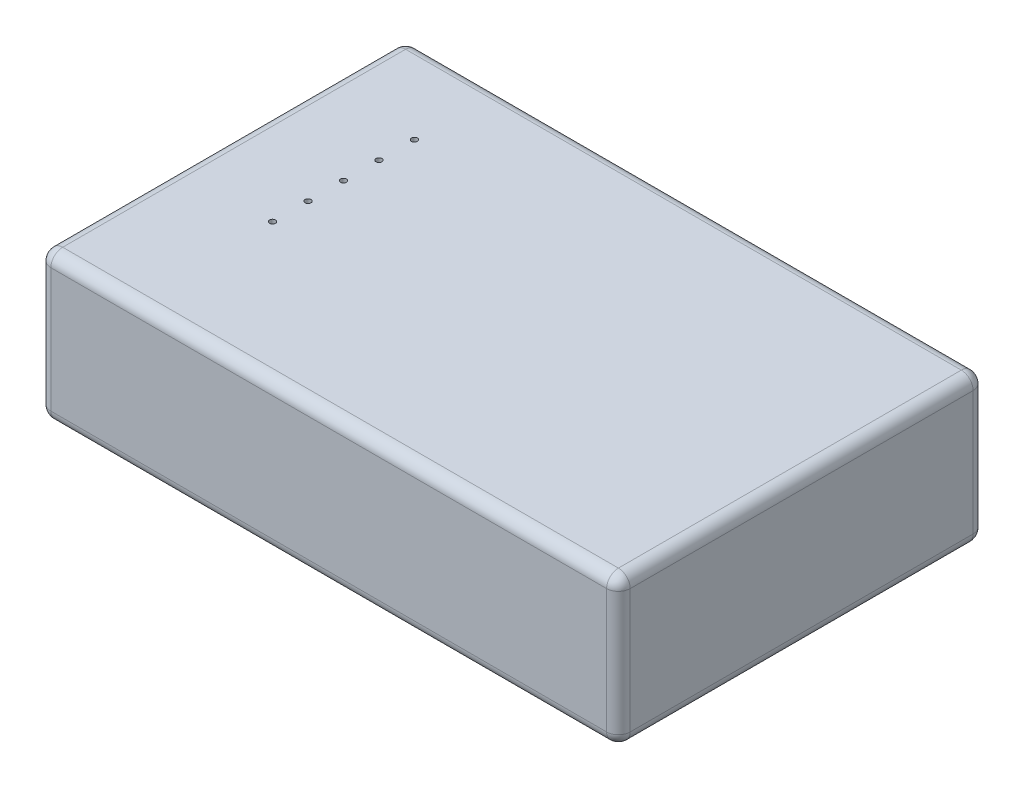
from build123d import *

# Parameters (mm, degrees)
SKETCH2_W           = 98
SKETCH2_H           = 62
BOSS_EXTRUDE1_DEPTH = 25
SKETCH3_W           = 9.5
SKETCH3_H           = 12
BOSS_EXTRUDE4_DEPTH = 1
SKETCH3_5_W         = 9.5
SKETCH3_5_H         = 12
CUT_EXTRUDE1_DEPTH  = 1
SKETCH4_R           = 3.25
CUT_EXTRUDE2_DEPTH  = 10
SKETCH5_R           = 0.5
BOSS_EXTRUDE5_DEPTH = 8
SKETCH6_W           = 7
SKETCH6_H           = 14
CUT_EXTRUDE9_DEPTH  = 10
SKETCH7_W           = 1.559437484
SKETCH7_H           = 10
BOSS_EXTRUDE6_DEPTH = 9
SKETCH8_W           = 15
SKETCH8_H           = 10
BOSS_EXTRUDE7_DEPTH = 2
BOSS_EXTRUDE7_TAPER = 30
BOSS_EXTRUDE8_DEPTH = 6
FILLET5_R           = 2
SKETCH10_R          = 2.5
CUT_EXTRUDE10_DEPTH = 6
SKETCH11_R          = 0.5
CUT_EXTRUDE11_DEPTH = 3


with BuildPart() as part:
    # Sketch2 → Boss-Extrude1 (new body)
    with BuildSketch(Plane(origin=(0, 0, 0), x_dir=(1, 0, 0), z_dir=(0, 1, 0))):
        Rectangle(SKETCH2_W, SKETCH2_H)
    extrude(amount=BOSS_EXTRUDE1_DEPTH)

    # Sketch3 → Boss-Extrude4 (add)
    with BuildSketch(Plane.ZY.offset(49)):
        with Locations((-18.656971736, 15)):
            Rectangle(SKETCH3_W, SKETCH3_H)
    extrude(amount=-BOSS_EXTRUDE4_DEPTH)

    # Sketch3<5> → Cut-Extrude1 (cut)
    with BuildSketch(Plane.ZY.offset(49)):
        with Locations((-18.656971736, 15)):
            Rectangle(SKETCH3_5_W, SKETCH3_5_H)
    extrude(amount=-CUT_EXTRUDE1_DEPTH, mode=Mode.SUBTRACT)

    # Sketch4 → Cut-Extrude2 (cut)
    with BuildSketch(Plane.ZY.offset(48)):
        with Locations((-18.406971736, 16)):
            Circle(SKETCH4_R)
    extrude(amount=-CUT_EXTRUDE2_DEPTH, mode=Mode.SUBTRACT)

    # Sketch5 → Boss-Extrude5 (add)
    with BuildSketch(Plane.ZY.offset(38)):
        with Locations((-18.406971736, 16)):
            Circle(SKETCH5_R)
    extrude(amount=BOSS_EXTRUDE5_DEPTH)

    # Sketch6 → Cut-Extrude9 (cut)
    with BuildSketch(Plane.ZY.offset(49)):
        with Locations((-6.406971736, 14)):
            Rectangle(SKETCH6_W, SKETCH6_H)
    extrude(amount=-CUT_EXTRUDE9_DEPTH, mode=Mode.SUBTRACT)

    # Sketch7 → Boss-Extrude6 (add)
    with BuildSketch(Plane.ZY.offset(39)):
        with Locations((-4.686690478, 14)):
            Rectangle(SKETCH7_W, SKETCH7_H)
    extrude(amount=BOSS_EXTRUDE6_DEPTH)

    # Sketch8 → Boss-Extrude7 (add)
    with BuildSketch(Plane.ZY.offset(49)):
        with Locations((12.093028264, 15)):
            Rectangle(SKETCH8_W, SKETCH8_H)
    extrude(amount=BOSS_EXTRUDE7_DEPTH, taper=BOSS_EXTRUDE7_TAPER)

    # Sketch9 → Boss-Extrude8 (add)
    with BuildSketch(Plane(origin=(0, 12, 0), x_dir=(-1, 0, 0), z_dir=(0, -1, 0))):
        with BuildLine():
            Line((51, -7.644654734), (51, -16.805465041))
            add(Edge.make_bspline(
                [(53.813384295, -15.000246539), (53.104445278, -16.821688465), (51, -16.805465041)],
                knots=[0, 0, 0, 1, 1, 1], degree=2))
            add(Edge.make_bspline(
                [(51, -7.644654734), (51.419023322, -11.667929153), (53.813384295, -15.000246539)],
                knots=[0, 0, 0, 1, 1, 1], degree=2))
        make_face()
    extrude(amount=-BOSS_EXTRUDE8_DEPTH)

    # Fillet5
    fillet5_edges = [part.edges().sort_by_distance(p)[0] for p in [
        (0, 25, 31),
        (-49, 25, 0),
        (0, 25, -31),
        (-49, 0, 0),
        (0, 0, 31),
        (49, 0, 0),
        (0, 0, -31),
        (49, 25, 0),
        (-49, 12.5, -31),
        (-49, 12.5, 31),
        (49, 12.5, 31),
        (49, 12.5, -31),
    ]]
    fillet(fillet5_edges, radius=FILLET5_R)

    # Sketch10 → Cut-Extrude10 (cut)
    with BuildSketch(Plane.XZ):
        with Locations(Location((-43, -25.5, 0), (0, 0, 270))):
            Circle(SKETCH10_R)
        with Locations(Location((-43, 25.5, 0), (0, 0, 270))):
            Circle(SKETCH10_R)
        with Locations(Location((43, 25.5, 0), (0, 0, 270))):
            Circle(SKETCH10_R)
        with Locations(Location((43, -25.5, 0), (0, 0, 270))):
            Circle(SKETCH10_R)
    extrude(amount=-CUT_EXTRUDE10_DEPTH, mode=Mode.SUBTRACT)

    # Sketch11 → Cut-Extrude11 (cut)
    with BuildSketch(Plane(origin=(0, 25, 0), x_dir=(1, 0, 0), z_dir=(0, 1, 0))):
        with Locations(Location((-33, 16.5, 0), (0, 0, 270))):
            Circle(SKETCH11_R)
        with Locations(Location((-33, 10.5, 0), (0, 0, 270))):
            Circle(SKETCH11_R)
        with Locations(Location((-33, 4.5, 0), (0, 0, 270))):
            Circle(SKETCH11_R)
        with Locations(Location((-33, -1.5, 0), (0, 0, 270))):
            Circle(SKETCH11_R)
        with Locations(Location((-33, -7.5, 0), (0, 0, 270))):
            Circle(SKETCH11_R)
    extrude(amount=-CUT_EXTRUDE11_DEPTH, mode=Mode.SUBTRACT)


solid = part.part
